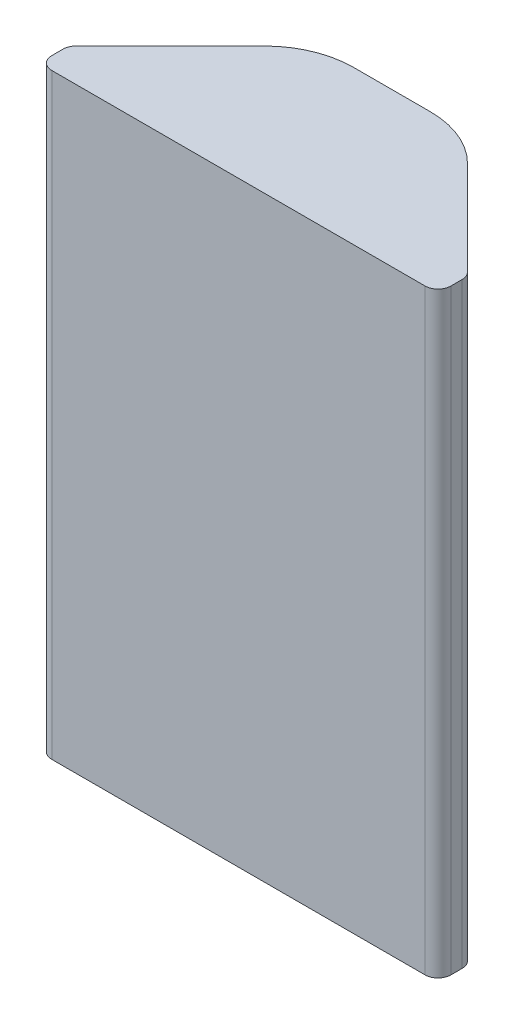
from build123d import *

# Parameters (mm, degrees)
BOSS_EXTRUDE1_DEPTH = 15


with BuildPart() as part:
    # Sketch3 → Boss-Extrude1 (new, symmetric)
    with BuildSketch(Plane(origin=(0, 0, 0), x_dir=(1, 0, 0), z_dir=(0, 1, 0))):
        with BuildLine():
            Line((-5.617617549, 4.318), (5.617617549, 4.318))
            Line((5.617617549, 4.318), (9.385342517, 4.318))
            ThreePointArc((9.385342517, 4.318), (9.843335579, 4.507706938), (10.033042517, 4.9657))
            Line((10.033042517, 4.9657), (10.033042517, 5.533957912))
            ThreePointArc((10.033042517, 5.533957912), (9.983739138, 5.781822339), (9.843335016, 5.991951537))
            Line((9.843335016, 5.991951537), (5.112460341, 10.722814576))
            ThreePointArc((5.112460341, 10.722814576), (3.653919205, 11.69737866), (1.933453584, 12.0396))
            Line((1.933453584, 12.0396), (-1.933453584, 12.0396))
            ThreePointArc((-1.933453584, 12.0396), (-3.653919205, 11.69737866), (-5.112460341, 10.722814576))
            Line((-5.112460341, 10.722814576), (-9.843335016, 5.991951537))
            ThreePointArc((-9.843335016, 5.991951537), (-9.983739138, 5.781822339), (-10.033042517, 5.533957912))
            Line((-10.033042517, 5.533957912), (-10.033042517, 4.9657))
            ThreePointArc((-10.033042517, 4.9657), (-9.843335579, 4.507706938), (-9.385342517, 4.318))
            Line((-9.385342517, 4.318), (-5.617617549, 4.318))
        make_face()
    extrude(amount=BOSS_EXTRUDE1_DEPTH, both=True)


solid = part.part
